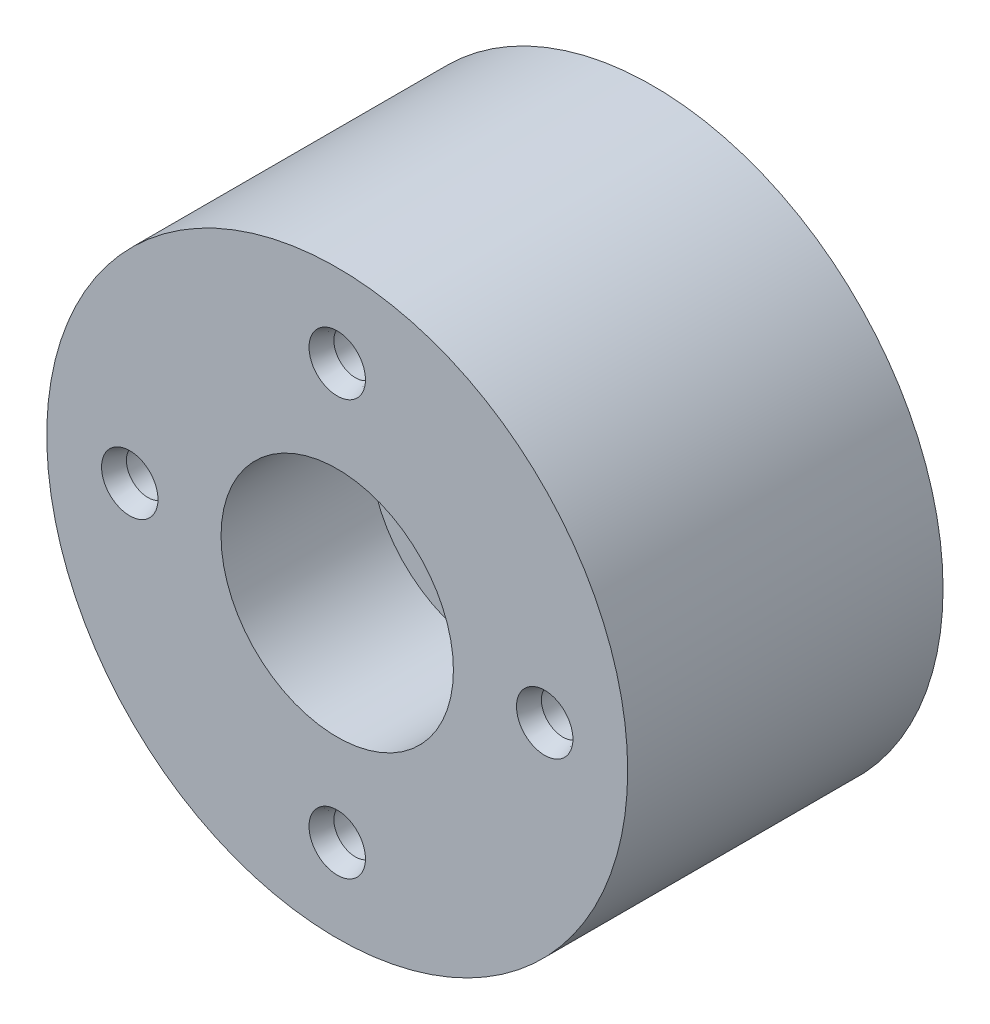
from build123d import *

# Parameters (mm, degrees)
SKETCH_1_R          = 17.5
EXTRUDE_1_DEPTH     = 19
SKETCH_2_R          = 1.3
CUT_EXTRUDE_1_DEPTH = 8
SKETCH_4_R          = 7
CUT_EXTRUDE_3_DEPTH = 9
SKETCH_5_R          = 5.55
CUT_EXTRUDE_4_DEPTH = 10
CUT_EXTRUDE_START   = -8
CUT_EXTRUDE_6_DEPTH = 8
FILLET_2_R          = 0.8
CHAMFER_1_SIZE      = 0.9
CHAMFER_1_SIZE2     = 1.558845727
CHAMFER_2_SIZE      = 0.4
CHAMFER_2_SIZE2     = 1.098990968
FILLET_3_R          = 0.8


with BuildPart() as part:
    # 草图1 → 凸台-拉伸1 (new body)
    with BuildSketch(Plane.XY):
        Circle(SKETCH_1_R)
    extrude(amount=-EXTRUDE_1_DEPTH)

    # 草图2 → 切除-拉伸1 (cut)
    with BuildSketch(Plane.XY):
        with Locations((12.5, 0)):
            Circle(SKETCH_2_R)
        with Locations((0, -12.5)):
            Circle(SKETCH_2_R)
        with Locations((-12.5, 0)):
            Circle(SKETCH_2_R)
        with Locations((0, 12.5)):
            Circle(SKETCH_2_R)
    extrude(amount=-CUT_EXTRUDE_1_DEPTH, mode=Mode.SUBTRACT)

    # 草图4 → 切除-拉伸3 (cut)
    with BuildSketch(Plane.XY):
        Circle(SKETCH_4_R)
    extrude(amount=-CUT_EXTRUDE_3_DEPTH, mode=Mode.SUBTRACT)

    # 草图5 → 切除-拉伸4 (cut)
    with BuildSketch(Plane.XY.offset(-9)):
        Circle(SKETCH_5_R)
    extrude(amount=-CUT_EXTRUDE_4_DEPTH, mode=Mode.SUBTRACT)

    # 草图6 → 切除-拉伸6 (cut)
    with BuildSketch(Plane(origin=(0, 0, -19), x_dir=(-1, 0, 0), z_dir=(0, 0, -1)).offset(CUT_EXTRUDE_START)):
        with BuildLine():
            Line((7.095083956, 5.939889195), (14.583381366, 9.673416559))
            ThreePointArc((14.583381366, 9.673416559), (15.661351328, 7.808461729), (16.502031962, 5.825198805))
            Line((16.502031962, 5.825198805), (9.013734553, 2.091671441))
            ThreePointArc((9.013734553, 2.091671441), (6.130300377, 3.05645502), (7.095083956, 5.939889195))
        make_face()
    extrude(amount=CUT_EXTRUDE_6_DEPTH, mode=Mode.SUBTRACT)

    # 圆角2
    fillet_2_edges = [part.edges().sort_by_distance(p)[0] for p in [
        (-6.130300377, 3.05645502, -11),
        (-10.839232661, 7.806652877, -11),
        (-12.757883257, 3.958435123, -11),
    ]]
    fillet(fillet_2_edges, radius=FILLET_2_R)

    # 倒角1
    chamfer_1_edges = [part.edges().sort_by_distance(p)[0] for p in [
        (-5.55, 0, -19),
    ]]
    chamfer_1_side = [part.faces().sort_by_distance(p)[0] for p in [
        (-2.871452094, -16.760836695, -19),
    ]]
    chamfer(chamfer_1_edges, length=CHAMFER_1_SIZE, length2=CHAMFER_1_SIZE2, reference=chamfer_1_side[0])

    # 倒角2
    chamfer_2_edges = [part.edges().sort_by_distance(p)[0] for p in [
        (-1.3, -12.5, 0),
        (-13.8, 0, 0),
        (-1.3, 12.5, 0),
        (11.2, 0, 0),
    ]]
    chamfer_2_side = [part.faces().sort_by_distance(p)[0] for p in [
        (-17.005025253, 0, 0),
    ]]
    chamfer(chamfer_2_edges, length=CHAMFER_2_SIZE, length2=CHAMFER_2_SIZE2, reference=chamfer_2_side[0])

    # 圆角3
    fillet_3_edges = [part.edges().sort_by_distance(p)[0] for p in [
        (-15.661351328, 7.808461729, -11),
        (-16.502031962, 5.825198805, -15.4),
        (-14.583381366, 9.673416559, -15.4),
        (-16.421826211, 6.047613073, -11.233795824),
        (-14.712740273, 9.475509151, -11.233795824),
    ]]
    fillet(fillet_3_edges, radius=FILLET_3_R)


solid = part.part
